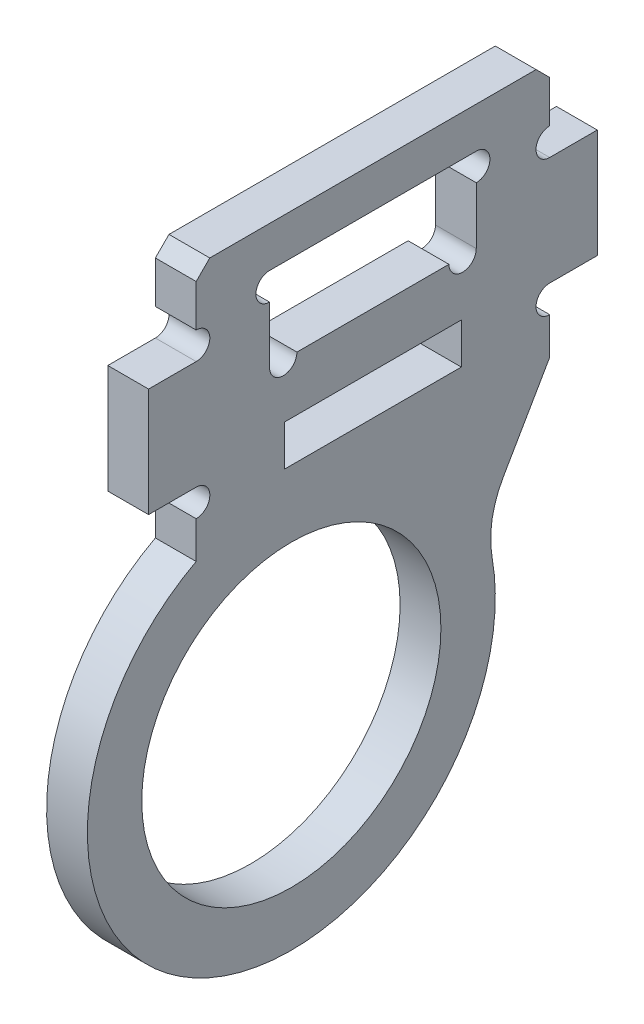
from build123d import *

# Parameters (mm, degrees)
SKETCH_1_R      = 11
SKETCH_1_W      = 13
SKETCH_1_H      = 3
EXTRUDE_1_DEPTH = 3
FILLET_1_R      = 7
CHAMFER_1_SIZE  = 1


with BuildPart() as part:
    # 草图1 → 凸台-拉伸1 (new body)
    with BuildSketch(Plane(origin=(0, 0, 0), x_dir=(0, 0, -1), z_dir=(1, 0, 0))):
        with BuildLine():
            Line((13, 6.1), (-13, 6.1))
            Line((-13, 6.1), (-13, 2.01))
            ThreePointArc((-13, 2.01), (-12.289357685, 1.715642315), (-11.995, 1.005))
            ThreePointArc((-11.995, 1.005), (-12.289357685, 0.294357685), (-13, 0))
            Line((-13, 0), (-16.5, 0))
            Line((-16.5, 0), (-16.5, -8))
            Line((-16.5, -8), (-13, -8))
            ThreePointArc((-13, -8), (-12.289357685, -8.294357685), (-11.995, -9.005))
            ThreePointArc((-11.995, -9.005), (-12.289357685, -9.715642315), (-13, -10.01))
            Line((-13, -10.01), (-13, -12.733500839))
            ThreePointArc((-13, -12.733500839), (-11.507561308, -39.952303338), (8.174286015, -21.091882644))
            Line((8.174286015, -21.091882644), (13, -12.733500839))
            Line((13, -12.733500839), (13, -10.01))
            ThreePointArc((13, -10.01), (11.995, -9.005), (13, -8))
            Line((13, -8), (16.5, -8))
            Line((16.5, -8), (16.5, 0))
            Line((16.5, 0), (13, 0))
            ThreePointArc((13, 0), (11.995, 1.005), (13, 2.01))
            Line((13, 2.01), (13, 6.1))
        make_face()
        with Locations((-6, -26)):
            Circle(SKETCH_1_R, mode=Mode.SUBTRACT)
        with Locations((0, -8.6)):
            Rectangle(SKETCH_1_W, SKETCH_1_H, mode=Mode.SUBTRACT)
        with BuildLine():
            Line((5.59, -3.1), (-5.59, -3.1))
            ThreePointArc((-5.59, -3.1), (-6.595, -4.105), (-7.6, -3.1))
            Line((-7.6, -3.1), (-7.6, 1.09))
            ThreePointArc((-7.6, 1.09), (-8.605, 2.095), (-7.6, 3.1))
            Line((-7.6, 3.1), (7.6, 3.1))
            ThreePointArc((7.6, 3.1), (8.310642315, 2.805642315), (8.605, 2.095))
            ThreePointArc((8.605, 2.095), (8.310642315, 1.384357685), (7.6, 1.09))
            Line((7.6, 1.09), (7.6, -3.1))
            ThreePointArc((7.6, -3.1), (6.595, -4.105), (5.59, -3.1))
        make_face(mode=Mode.SUBTRACT)
    extrude(amount=EXTRUDE_1_DEPTH)

    # 圆角1
    fillet_1_edges = [part.edges().sort_by_distance(p)[0] for p in [
        (1.5, -21.091882644, -8.174286015),
    ]]
    fillet(fillet_1_edges, radius=FILLET_1_R)

    # 倒角1
    chamfer_1_edges = [part.edges().sort_by_distance(p)[0] for p in [
        (1.5, 6.1, 13),
        (1.5, 6.1, -13),
    ]]
    chamfer(chamfer_1_edges, length=CHAMFER_1_SIZE)


solid = part.part
